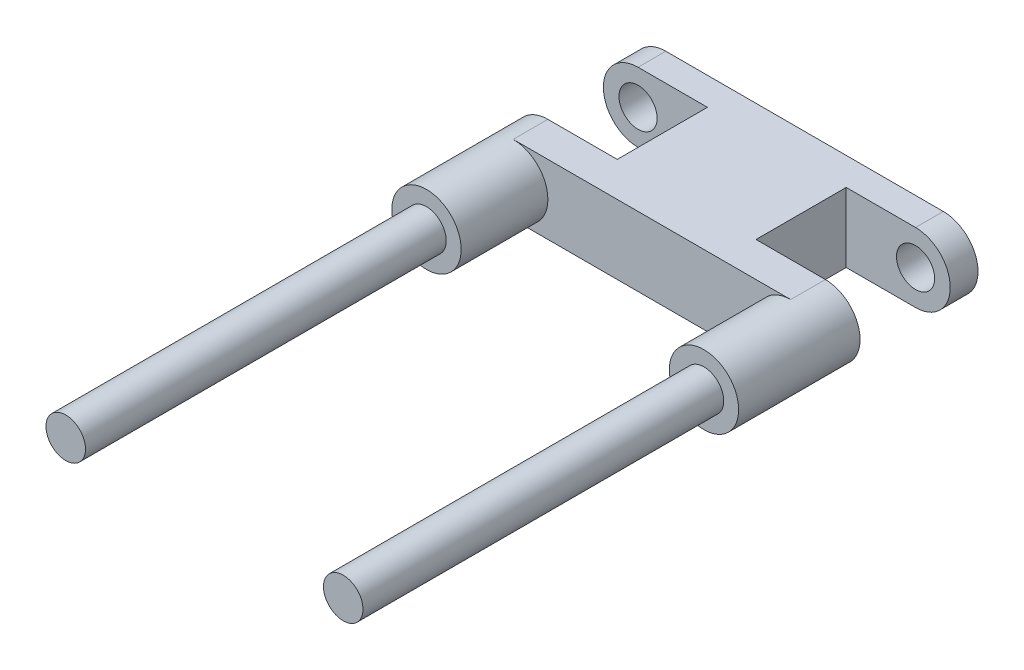
from build123d import *

# Parameters (mm, degrees)
SKETCH1_R           = 5
SKETCH1_R_2         = 2.75
BOSS_EXTRUDE1_DEPTH = 2
SKETCH2_W           = 10
SKETCH2_H           = 10
BOSS_EXTRUDE2_DEPTH = 15
SKETCH3_R           = 2.75
SKETCH3_W           = 20
SKETCH3_H           = 10
BOSS_EXTRUDE3_DEPTH = 5
SKETCH4_R           = 5
BOSS_EXTRUDE4_DEPTH = 12.5
SKETCH5_R           = 2.85
BOSS_EXTRUDE5_DEPTH = 52
BOSS_EXTRUDE6_START = 5
SKETCH6_R           = 2.75
BOSS_EXTRUDE6_DEPTH = 5
SKETCH8_R           = 2.75
BOSS_EXTRUDE7_DEPTH = 2


with BuildPart() as part:
    # Sketch1 → Boss-Extrude1 (new body)
    # profile 1 of 3: a face of its own
    with BuildSketch(Plane.XY):
        with Locations((-20, -30)):
            Circle(SKETCH1_R)
        with Locations((-20, -30)):
            Circle(SKETCH1_R_2, mode=Mode.SUBTRACT)
    # profile 2 of 3: a face of its own
    with BuildSketch(Plane.XY):
        with BuildLine():
            Line((20, -25), (-20, -25))
            ThreePointArc((-20, -25), (-16.464466094, -26.464466094), (-15, -30))
            ThreePointArc((-15, -30), (-16.464466094, -33.535533906), (-20, -35))
            Line((-20, -35), (20, -35))
            ThreePointArc((20, -35), (15, -30), (20, -25))
        make_face()
    # profile 3 of 3: a face of its own
    with BuildSketch(Plane.XY):
        with Locations((20, -30)):
            Circle(SKETCH1_R)
        with Locations((20, -30)):
            Circle(SKETCH1_R_2, mode=Mode.SUBTRACT)
    extrude(amount=BOSS_EXTRUDE1_DEPTH)

    # Sketch2 → Boss-Extrude2 (add)
    with BuildSketch(Plane.XY.offset(2)):
        with Locations((-5, -30)):
            Rectangle(SKETCH2_W, SKETCH2_H)
        with Locations((5, -30)):
            Rectangle(SKETCH2_W, SKETCH2_H)
    extrude(amount=BOSS_EXTRUDE2_DEPTH)

    # Sketch3 → Boss-Extrude3 (add)
    # profile 1 of 3: a face of its own
    with BuildSketch(Plane.XY.offset(17)):
        with BuildLine():
            Line((-10, -25), (-20, -25))
            ThreePointArc((-20, -25), (-25, -30), (-20, -35))
            Line((-20, -35), (-10, -35))
            Line((-10, -35), (-10, -25))
        make_face()
        with Locations((-20, -30)):
            Circle(SKETCH3_R, mode=Mode.SUBTRACT)
    # profile 2 of 3: a face of its own
    with BuildSketch(Plane.XY.offset(17)):
        with Locations((0, -30)):
            Rectangle(SKETCH3_W, SKETCH3_H)
    # profile 3 of 3: a face of its own
    with BuildSketch(Plane.XY.offset(17)):
        with BuildLine():
            Line((10, -35), (20, -35))
            ThreePointArc((20, -35), (25, -30), (20, -25))
            Line((20, -25), (10, -25))
            Line((10, -25), (10, -35))
        make_face()
        with Locations((20, -30)):
            Circle(SKETCH3_R, mode=Mode.SUBTRACT)
    extrude(amount=BOSS_EXTRUDE3_DEPTH)

    # Sketch4 → Boss-Extrude4 (add)
    with BuildSketch(Plane.XY.offset(22)):
        with Locations(Location((20, -30, 0), (0, 0, 180))):
            Circle(SKETCH4_R)
        with Locations(Location((-20, -30, 0), (0, 0, 180))):
            Circle(SKETCH4_R)
    extrude(amount=BOSS_EXTRUDE4_DEPTH)

    # Sketch5 → Boss-Extrude5 (add)
    with BuildSketch(Plane.XY.offset(34.5)):
        with Locations((20, -30)):
            Circle(SKETCH5_R)
        with Locations((-20, -30)):
            Circle(SKETCH5_R)
    extrude(amount=BOSS_EXTRUDE5_DEPTH)

    # Sketch6 → Boss-Extrude6 (add)
    with BuildSketch(Plane(origin=(0, 0, 22), x_dir=(-1, 0, 0), z_dir=(0, 0, -1)).offset(BOSS_EXTRUDE6_START)):
        with Locations(Location((20, -30, 0), (0, 0, 180))):
            Circle(SKETCH6_R)
        with Locations(Location((-20, -30, 0), (0, 0, 180))):
            Circle(SKETCH6_R)
    extrude(amount=-BOSS_EXTRUDE6_DEPTH)

    # Sketch8 → Boss-Extrude7 (add)
    # profile 1 of 2: a face of its own
    with BuildSketch(Plane.XY.offset(2)):
        with BuildLine():
            Line((-10, -35), (-10, -25))
            Line((-10, -25), (-20, -25))
            ThreePointArc((-20, -25), (-25, -30), (-20, -35))
            Line((-20, -35), (-10, -35))
        make_face()
        with Locations((-20, -30)):
            Circle(SKETCH8_R, mode=Mode.SUBTRACT)
    # profile 2 of 2: a face of its own
    with BuildSketch(Plane.XY.offset(2)):
        with BuildLine():
            Line((20, -25), (10, -25))
            Line((10, -25), (10, -35))
            Line((10, -35), (20, -35))
            ThreePointArc((20, -35), (25, -30), (20, -25))
        make_face()
        with Locations((20, -30)):
            Circle(SKETCH8_R, mode=Mode.SUBTRACT)
    extrude(amount=BOSS_EXTRUDE7_DEPTH)


solid = part.part
